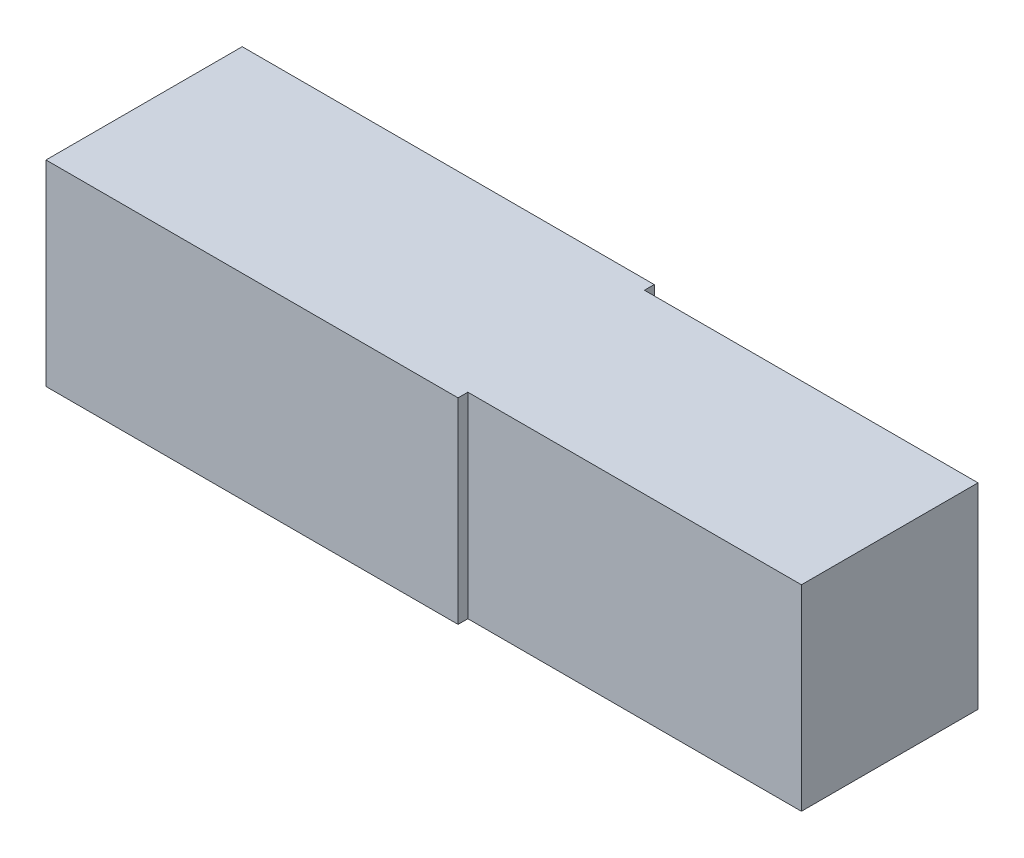
from build123d import *

# Parameters (mm, degrees)
SKETCH_1_W      = 21
SKETCH_1_H      = 10
SKETCH_1_W_2    = 17
SKETCH_1_H_2    = 9
EXTRUDE_1_DEPTH = 10


with BuildPart() as part:
    # 草图1 → 凸台-拉伸1 (new body)
    with BuildSketch(Plane(origin=(0, 0, 0), x_dir=(1, 0, 0), z_dir=(0, 1, 0))):
        Rectangle(SKETCH_1_W, SKETCH_1_H)
        with Locations((19, 0)):
            Rectangle(SKETCH_1_W_2, SKETCH_1_H_2)
    extrude(amount=EXTRUDE_1_DEPTH)


solid = part.part
